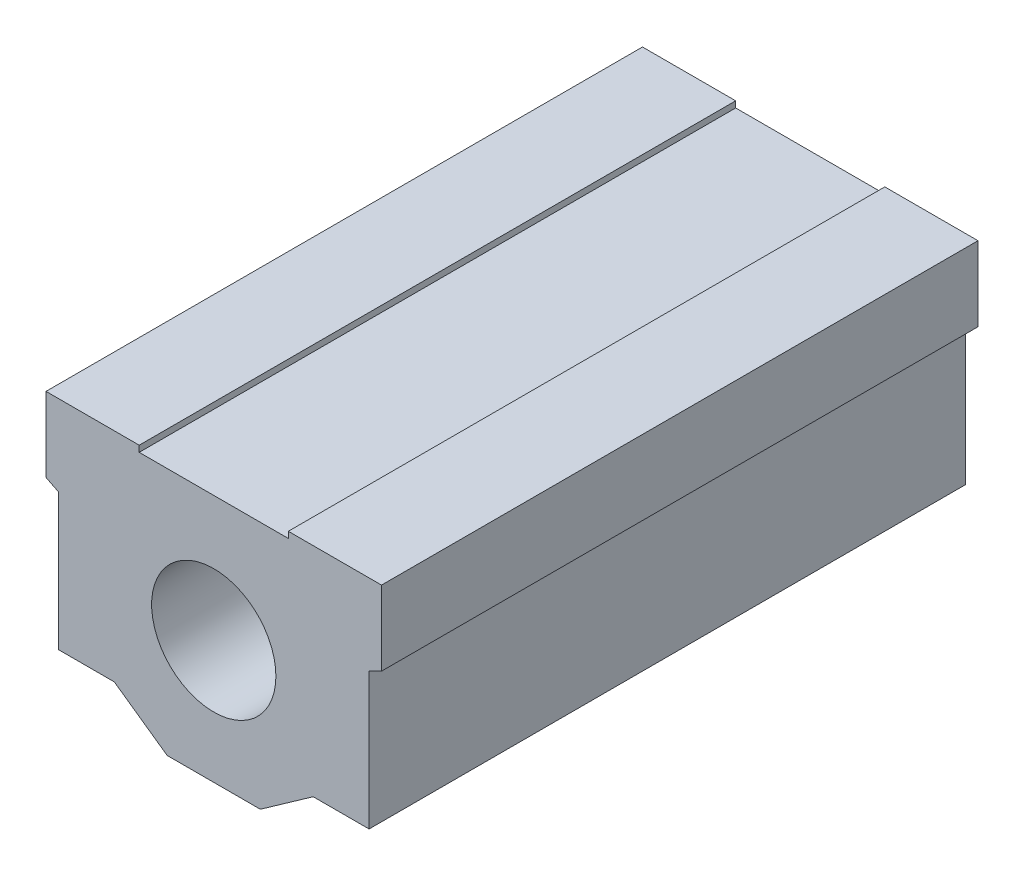
from build123d import *

# Parameters (mm, degrees)
SKETCH_1_R      = 10
EXTRUDE_1_DEPTH = 96


with BuildPart() as part:
    # 草图1 → 凸台-拉伸1 (new body)
    with BuildSketch(Plane.XY):
        Polygon((7.5, 0), (-7.5, 0), (-16, 6), (-25, 6), (-25, 28), (-27, 29), (-27, 41), (-12, 41), (-12, 40), (12, 40), (12, 41), (27, 41), (27, 29), (25, 28), (25, 6), (16, 6), align=None)
        with Locations((0, 19.8)):
            Circle(SKETCH_1_R, mode=Mode.SUBTRACT)
    extrude(amount=EXTRUDE_1_DEPTH)


solid = part.part
